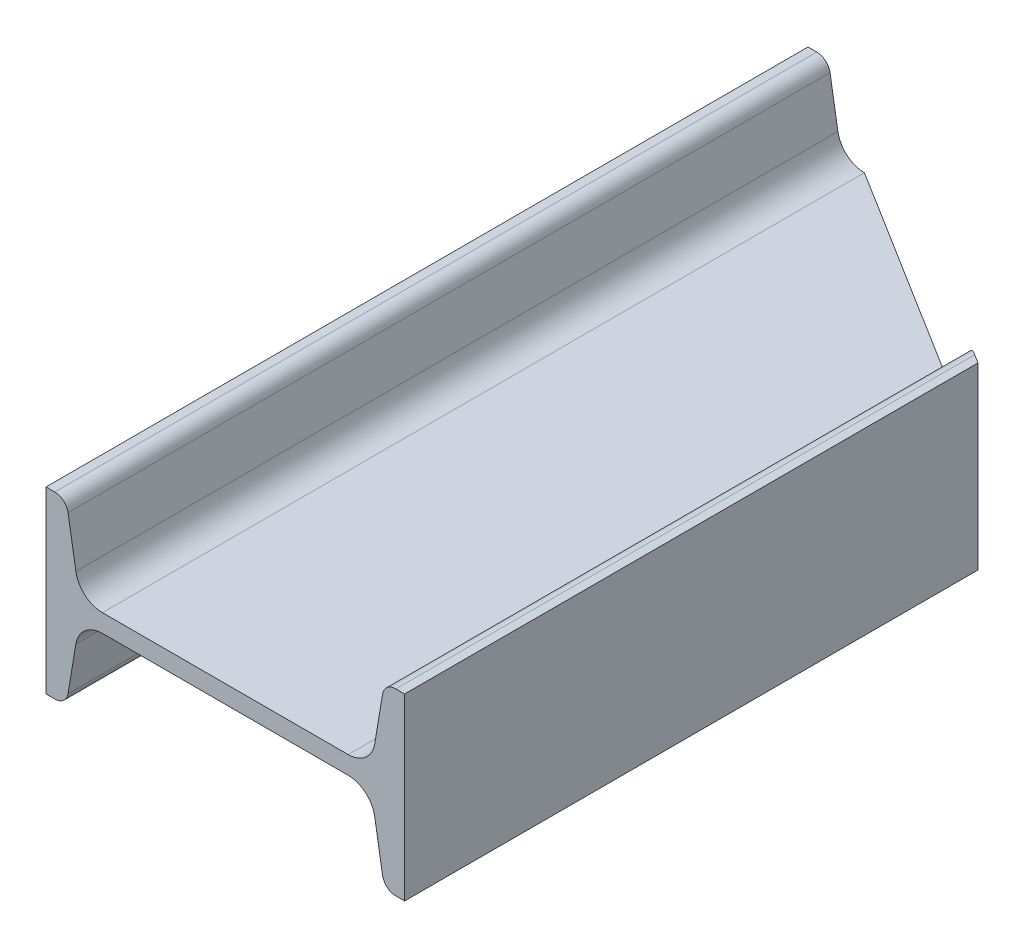
from build123d import *

# Parameters (mm, degrees)
VIGA_SB_80_X_6_1_DEPTH     = 170
CORTAR_EXTRUIR1_DEPTH      = 97.046863561
CORTAR_EXTRUIR1_DEPTH_BACK = 97.046863561


with BuildPart() as part:
    # Sketch1 → Viga sb 80 X 6(1) (new body)
    with BuildSketch(Plane.YX.offset(-85)):
        with BuildLine():
            Line((-20, -40), (-20, -38.041460212))
            ThreePointArc((-20, -38.041460212), (-19.289071417, -36.102349063), (-17.493231968, -35.082284275))
            Line((-17.493231968, -35.082284275), (-7.013536064, -33.335540875))
            ThreePointArc((-7.013536064, -33.335540875), (-3.421857166, -31.295411299), (-2, -27.417189001))
            Line((-2, -27.417189001), (-2, 27.417189001))
            ThreePointArc((-2, 27.417189001), (-3.421857166, 31.295411299), (-7.013536064, 33.335540875))
            Line((-7.013536064, 33.335540875), (-17.493231968, 35.082284275))
            ThreePointArc((-17.493231968, 35.082284275), (-19.289071417, 36.102349063), (-20, 38.041460212))
            Line((-20, 38.041460212), (-20, 40))
            Line((-20, 40), (20, 40))
            Line((20, 40), (20, 38.041460212))
            ThreePointArc((20, 38.041460212), (19.289071417, 36.102349063), (17.493231968, 35.082284275))
            Line((17.493231968, 35.082284275), (7.013536064, 33.335540875))
            ThreePointArc((7.013536064, 33.335540875), (3.421857166, 31.295411299), (2, 27.417189001))
            Line((2, 27.417189001), (2, -27.417189001))
            ThreePointArc((2, -27.417189001), (3.421857166, -31.295411299), (7.013536064, -33.335540875))
            Line((7.013536064, -33.335540875), (17.493231968, -35.082284275))
            ThreePointArc((17.493231968, -35.082284275), (19.289071417, -36.102349063), (20, -38.041460212))
            Line((20, -38.041460212), (20, -40))
            Line((20, -40), (-20, -40))
        make_face()
    extrude(amount=VIGA_SB_80_X_6_1_DEPTH)

    # Croquis3 → Cortar-Extruir1 (cut, two sides: drawn at the far end of the back side and taken through both)
    with BuildSketch(Plane(origin=(0, 0, 0), x_dir=(1, 0, 0), z_dir=(0, 1, 0)).offset(-CORTAR_EXTRUIR1_DEPTH_BACK)):
        Polygon((-27.417189001, 85), (71.271160363, 23.404541057), (71.271160363, 105.762435543), (-27.417189001, 105.762435543), align=None)
    extrude(amount=CORTAR_EXTRUIR1_DEPTH + CORTAR_EXTRUIR1_DEPTH_BACK, mode=Mode.SUBTRACT)


solid = part.part
